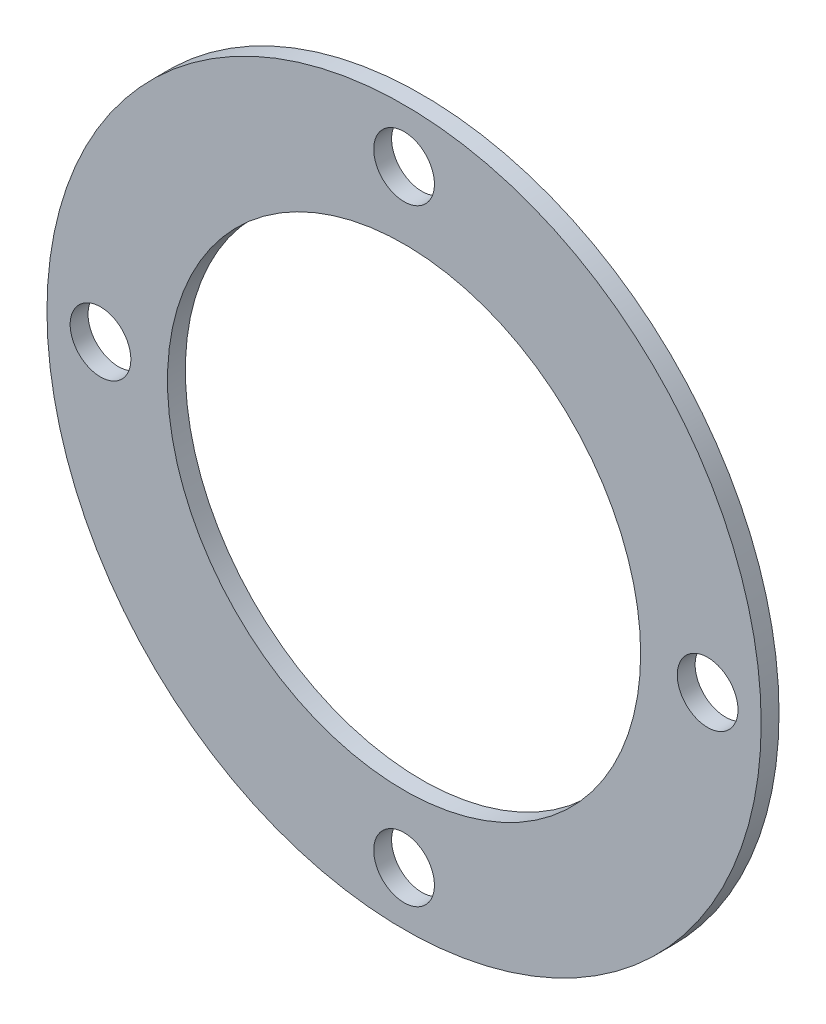
from build123d import *

# Parameters (mm, degrees)
SKETCH1_R                   = 20
BOSS_EXTRUDE1_DEPTH         = 1
SKETCH2_R                   = 13.25
CUT_EXTRUDE1_DEPTH          = 1
TAP_DRILL_FOR_M3X0_5_TAP1_D = 3.4


with BuildPart() as part:
    # Sketch1 → Boss-Extrude1 (new body)
    with BuildSketch(Plane.XY):
        Circle(SKETCH1_R)
    extrude(amount=BOSS_EXTRUDE1_DEPTH)

    # Sketch2 → Cut-Extrude1 (cut)
    with BuildSketch(Plane.XY.offset(1)):
        Circle(SKETCH2_R)
    extrude(amount=-CUT_EXTRUDE1_DEPTH, mode=Mode.SUBTRACT)

    # Tap Drill for M3x0.5 Tap1 (through all)
    with Locations(Plane.XY.offset(1)):
        with Locations((0, 17), (17, 0), (0, -17), (-17, 0)):
            Hole(TAP_DRILL_FOR_M3X0_5_TAP1_D / 2)


solid = part.part
